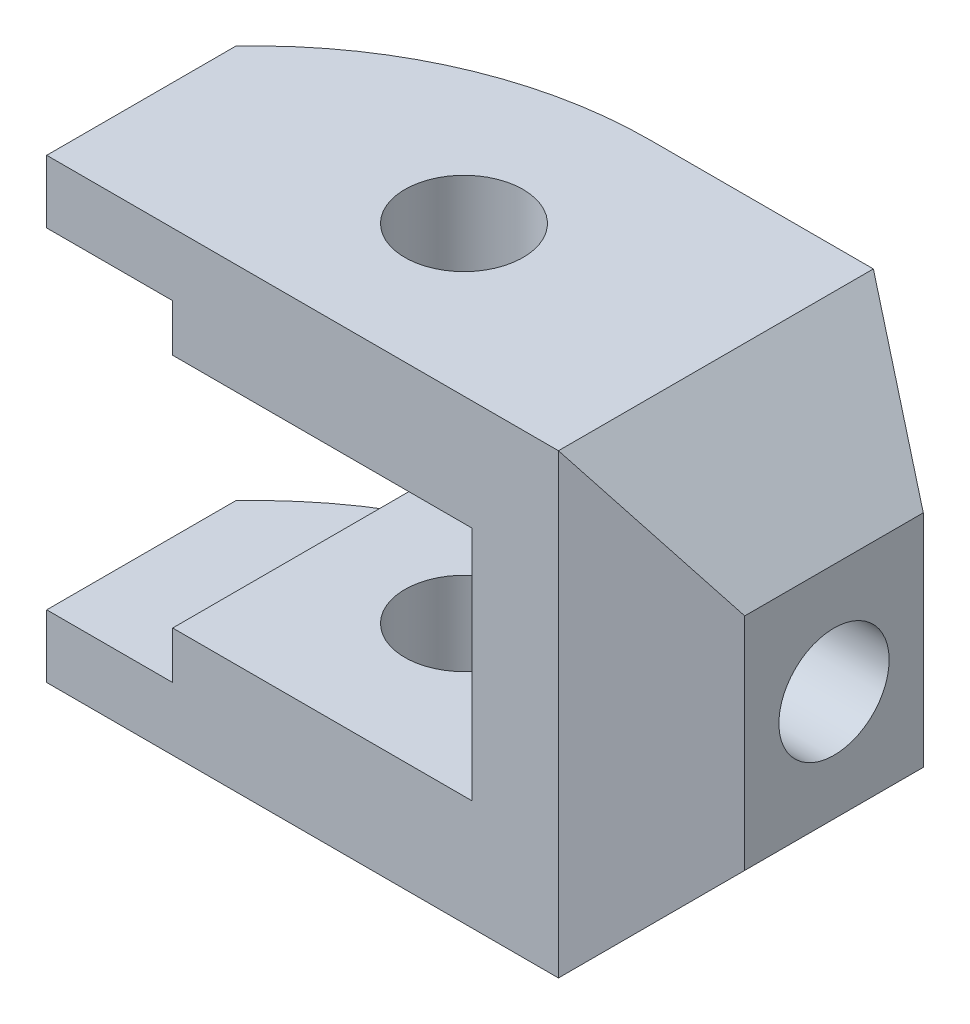
from build123d import *

# Parameters (mm, degrees)
SKETCH1_R           = 7.5
BOSS_EXTRUDE1_DEPTH = 58
CUT_EXTRUDE1_DEPTH  = 107.60206377
CUT_EXTRUDE2_DEPTH  = 107.60206377
SKETCH5_R           = 7
CUT_EXTRUDE3_DEPTH  = 107.60206377


with BuildPart() as part:
    # Sketch1 → Boss-Extrude1 (new body)
    with BuildSketch(Plane(origin=(0, 0, 0), x_dir=(1, 0, 0), z_dir=(0, 1, 0))):
        with BuildLine():
            Line((0, 0), (65, 0))
            Line((65, 0), (80, 8.660254038))
            Line((80, 8.660254038), (80, 31.339745962))
            Line((80, 31.339745962), (65, 40))
            Line((65, 40), (36.66060556, 40))
            ThreePointArc((36.66060556, 40), (16.66060556, 35.82575695), (0, 24))
            Line((0, 24), (0, 0))
        make_face()
        with Locations(Location((34, 19, 0), (0, 0, 90))):
            Circle(SKETCH1_R, mode=Mode.SUBTRACT)
    extrude(amount=BOSS_EXTRUDE1_DEPTH)

    # Sketch2 → Cut-Extrude1 (cut, through all)
    with BuildSketch(Plane.XY):
        Polygon((0, 50), (16, 50), (16, 44), (54, 44), (54, 14), (16, 14), (16, 8), (0, 8), align=None)
    extrude(amount=-CUT_EXTRUDE1_DEPTH, mode=Mode.SUBTRACT)

    # Sketch4 → Cut-Extrude2 (cut, through all)
    with BuildSketch(Plane.XY):
        Polygon((65, 58), (80, 43), (80, 58), align=None)
        Polygon((65, 0), (80, 0), (80, 15), align=None)
    extrude(amount=-CUT_EXTRUDE2_DEPTH, mode=Mode.SUBTRACT)

    # Sketch5 → Cut-Extrude3 (cut, through all)
    with BuildSketch(Plane(origin=(80, 0, 0), x_dir=(0, 0, -1), z_dir=(1, 0, 0))):
        with Locations((20, 29)):
            Circle(SKETCH5_R)
    extrude(amount=-CUT_EXTRUDE3_DEPTH, mode=Mode.SUBTRACT)


solid = part.part
